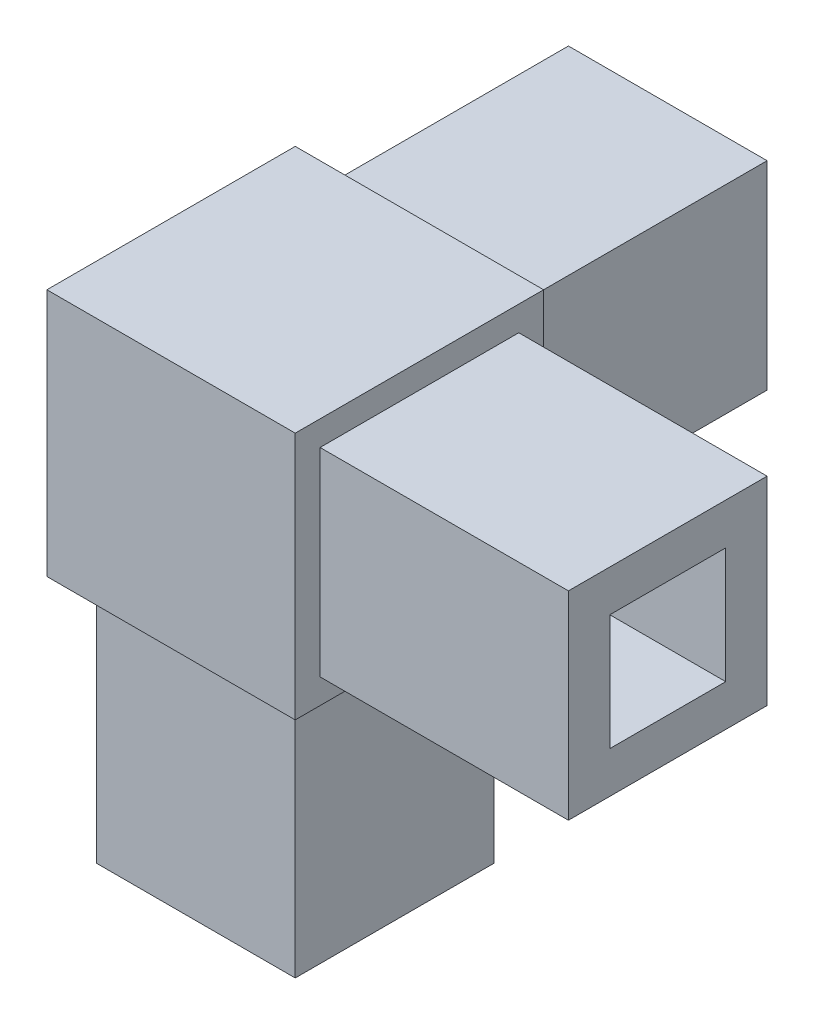
from build123d import *

# Parameters (mm, degrees)
CROQUIS1_W     = 30
CROQUIS1_H     = 30
EXTRUIR1_DEPTH = 30
CROQUIS5_W     = 30
CROQUIS5_H     = 30
EXTRUIR4_DEPTH = 30
CROQUIS2_W     = 30
CROQUIS2_H     = 30
CROQUIS2_W_2   = 24
CROQUIS2_H_2   = 24
EXTRUIR2_DEPTH = 30
CROQUIS3_W     = 30
CROQUIS3_H     = 30
CROQUIS3_W_2   = 24
CROQUIS3_H_2   = 24
EXTRUIR3_DEPTH = 30
CROQUIS7_W     = 30
CROQUIS7_H     = 30
CROQUIS7_W_2   = 24
CROQUIS7_H_2   = 24
EXTRUIR5_DEPTH = 30
VACIADO1_T     = -5


with BuildPart() as part:
    # Croquis1 → Extruir1 (new body)
    with BuildSketch(Plane(origin=(0, 0, 0), x_dir=(1, 0, 0), z_dir=(0, 1, 0))):
        with Locations((0, 30)):
            Rectangle(CROQUIS1_W, CROQUIS1_H)
        Rectangle(CROQUIS1_W, CROQUIS1_H)
        with Locations((30, 0)):
            Rectangle(CROQUIS1_W, CROQUIS1_H)
    extrude(amount=EXTRUIR1_DEPTH)

    # Croquis5 → Extruir4 (add)
    with BuildSketch(Plane.XZ):
        Rectangle(CROQUIS5_W, CROQUIS5_H)
    extrude(amount=EXTRUIR4_DEPTH)

    # Croquis2 → Extruir2 (cut)
    with BuildSketch(Plane(origin=(45, 0, 0), x_dir=(0, 0, -1), z_dir=(1, 0, 0))):
        with Locations((0, 15)):
            Rectangle(CROQUIS2_W, CROQUIS2_H)
        with Locations((0, 15)):
            Rectangle(CROQUIS2_W_2, CROQUIS2_H_2, mode=Mode.SUBTRACT)
    extrude(amount=-EXTRUIR2_DEPTH, mode=Mode.SUBTRACT)

    # Croquis3 → Extruir3 (cut)
    with BuildSketch(Plane(origin=(0, 0, -45), x_dir=(-1, 0, 0), z_dir=(0, 0, -1))):
        with Locations((0, 15)):
            Rectangle(CROQUIS3_W, CROQUIS3_H)
        with Locations((0, 15)):
            Rectangle(CROQUIS3_W_2, CROQUIS3_H_2, mode=Mode.SUBTRACT)
    extrude(amount=-EXTRUIR3_DEPTH, mode=Mode.SUBTRACT)

    # Croquis7 → Extruir5 (cut)
    with BuildSketch(Plane.XZ.offset(30)):
        Rectangle(CROQUIS7_W, CROQUIS7_H)
        Rectangle(CROQUIS7_W_2, CROQUIS7_H_2, mode=Mode.SUBTRACT)
    extrude(amount=-EXTRUIR5_DEPTH, mode=Mode.SUBTRACT)

    # Vaciado1
    vaciado1_openings = [part.faces().sort_by_distance(p)[0] for p in [
        (45, 15, 0),
        (0, 15, -45),
        (0, -30, 0),
    ]]
    offset(amount=VACIADO1_T, openings=vaciado1_openings, kind=Kind.INTERSECTION)


solid = part.part
